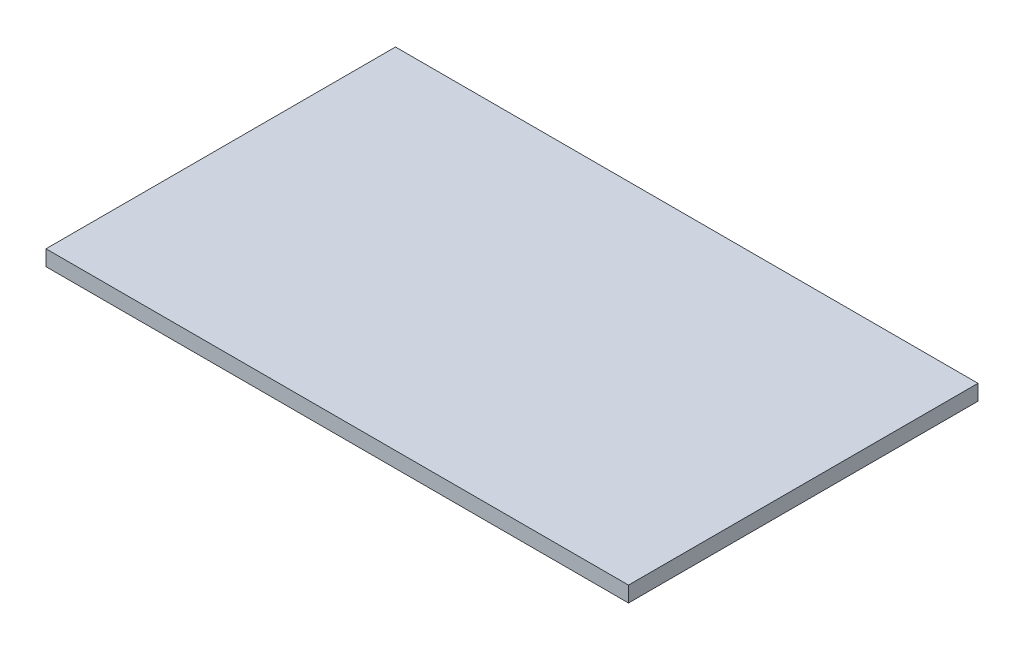
from build123d import *

# Parameters (mm, degrees)
SKETCH_1_W      = 75
SKETCH_1_H      = 45
EXTRUDE_1_DEPTH = 2


with BuildPart() as part:
    # 草图1 → 凸台-拉伸1 (new body)
    with BuildSketch(Plane(origin=(0, 0, 0), x_dir=(1, 0, 0), z_dir=(0, 1, 0))):
        Rectangle(SKETCH_1_W, SKETCH_1_H)
    extrude(amount=EXTRUDE_1_DEPTH)


solid = part.part
